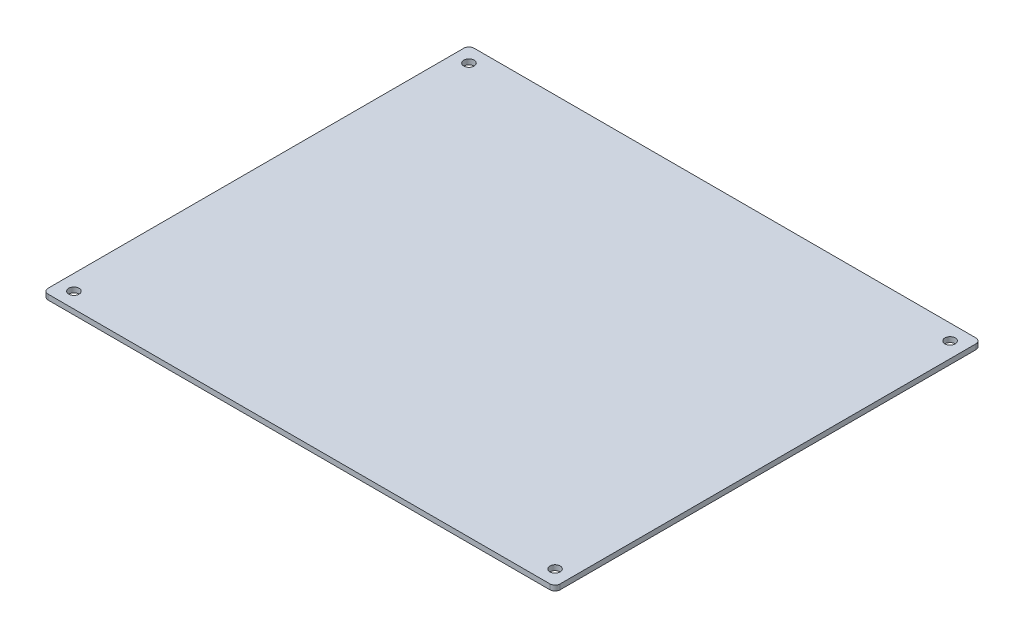
from build123d import *

# Parameters (mm, degrees)
SKETCH1_W           = 297.47
SKETCH1_H           = 247.47
SKETCH1_R           = 3
BOSS_EXTRUDE1_DEPTH = 3
FILLET1_R           = 3


with BuildPart() as part:
    # Sketch1 → Boss-Extrude1 (new body)
    with BuildSketch(Plane(origin=(0, 0, 0), x_dir=(1, 0, 0), z_dir=(0, 1, 0))):
        with Locations((148.735, 123.735)):
            Rectangle(SKETCH1_W, SKETCH1_H)
        with Locations(Location((9, 238.47, 0), (0, 0, 270))):
            Circle(SKETCH1_R, mode=Mode.SUBTRACT)
        with Locations(Location((288.47, 238.47, 0), (0, 0, 90))):
            Circle(SKETCH1_R, mode=Mode.SUBTRACT)
        with Locations(Location((288.47, 9, 0), (0, 0, 270))):
            Circle(SKETCH1_R, mode=Mode.SUBTRACT)
        with Locations(Location((9, 9, 0), (0, 0, 90))):
            Circle(SKETCH1_R, mode=Mode.SUBTRACT)
    extrude(amount=BOSS_EXTRUDE1_DEPTH)

    # Fillet1
    fillet1_edges = [part.edges().sort_by_distance(p)[0] for p in [
        (0, 1.5, -247.47),
        (297.47, 1.5, -247.47),
        (297.47, 1.5, 0),
        (0, 1.5, 0),
    ]]
    fillet(fillet1_edges, radius=FILLET1_R)


solid = part.part
